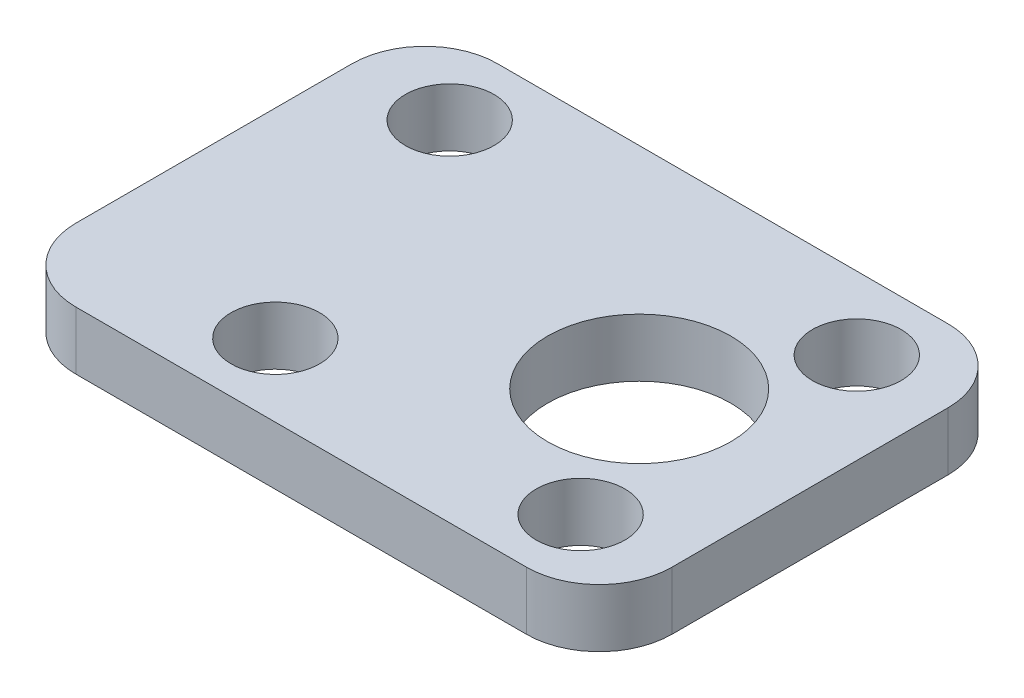
from build123d import *

# Parameters (mm, degrees)
SKETCH1_W            = 82
SKETCH1_H            = 58
SKETCH1_R            = 12.6
SKETCH1_R_2          = 6.1
BOSS_EXTRUDE1_DEPTH  = 8
FILLET1_R            = 10
FILLET1_OF_MIRROR1_R = 10
SKETCH2_W            = 82
SKETCH2_H            = 58
CUT_EXTRUDE1_DEPTH   = 175.137876408


with BuildPart() as part:
    # Sketch1 → Boss-Extrude1 (new body)
    with BuildSketch(Plane(origin=(0, 0, 0), x_dir=(1, 0, 0), z_dir=(0, 1, 0))):
        with Locations((41, 29)):
            Rectangle(SKETCH1_W, SKETCH1_H)
        with Locations(Location((23.5, 29, 0), (0, 0, 270))):
            Circle(SKETCH1_R, mode=Mode.SUBTRACT)
        with Locations(Location((68.57, 48, 0), (0, 0, 270))):
            Circle(SKETCH1_R_2, mode=Mode.SUBTRACT)
        with Locations(Location((54.561074274, 10, 0), (0, 0, 270))):
            Circle(SKETCH1_R_2, mode=Mode.SUBTRACT)
        with Locations(Location((12.561074274, 10, 0), (0, 0, 270))):
            Circle(SKETCH1_R_2, mode=Mode.SUBTRACT)
        with Locations(Location((12.561074274, 48, 0), (0, 0, 270))):
            Circle(SKETCH1_R_2, mode=Mode.SUBTRACT)
    boss_extrude1 = extrude(amount=BOSS_EXTRUDE1_DEPTH)

    # Fillet1
    fillet1_edges = [part.edges().sort_by_distance(p)[0] for p in [
        (0, 4, 0),
        (0, 4, -58),
        (82, 4, -58),
        (82, 4, 0),
    ]]
    fillet(fillet1_edges, radius=FILLET1_R)


with BuildPart() as mirror1_1:
    # Mirror1: Boss-Extrude1 across plane
    add(boss_extrude1.mirror(Plane(origin=(82, 8, 0), x_dir=(0, 0, 1), z_dir=(-1, 0, 0))))

    # Fillet1 of Mirror1
    fillet1_of_mirror1_edges = [mirror1_1.edges().sort_by_distance(p)[0] for p in [
        (164, 4, 0),
        (164, 4, -58),
        (82, 4, -58),
        (82, 4, 0),
    ]]
    fillet(fillet1_of_mirror1_edges, radius=FILLET1_OF_MIRROR1_R)


with BuildPart() as part_1:
    add(part.part)

    # Mirror1 united with what the copies touc: union Mirror1_1
    add(mirror1_1.part)

    # Sketch2 → Cut-Extrude1 (cut, through all)
    with BuildSketch(Plane(origin=(0, 8, 0), x_dir=(1, 0, 0), z_dir=(0, 1, 0))):
        with Locations((41, 29)):
            Rectangle(SKETCH2_W, SKETCH2_H)
    extrude(amount=-CUT_EXTRUDE1_DEPTH, mode=Mode.SUBTRACT)


solid = part_1.part
